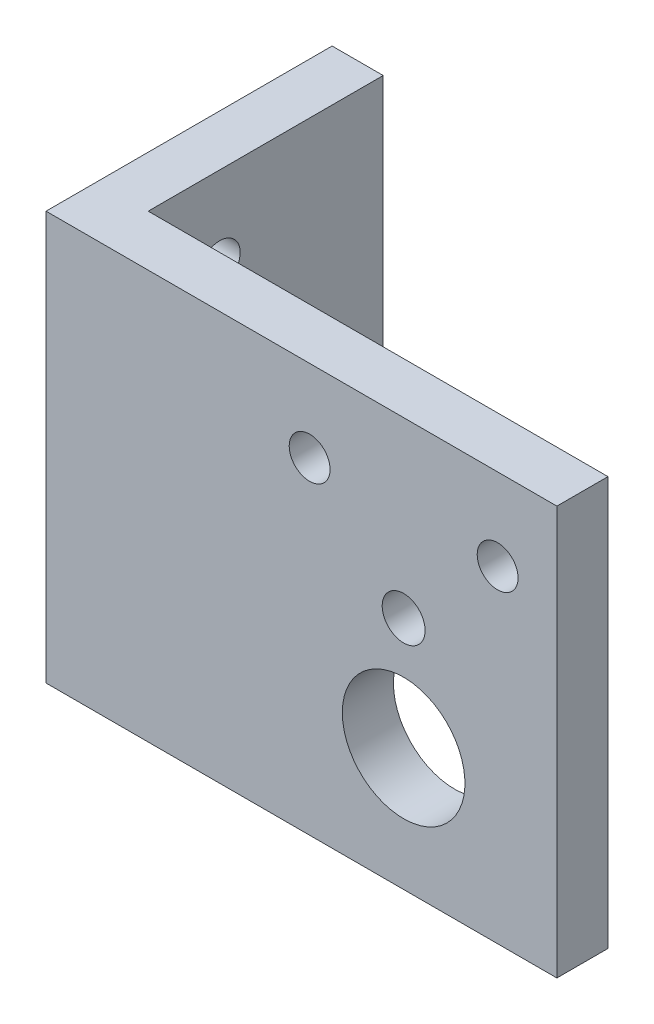
from build123d import *

# Parameters (mm, degrees)
BOSS_EXTRUDE2_DEPTH = 40
SKETCH3_R           = 6
SKETCH3_R_2         = 2.1
SKETCH3_R_3         = 2
CUT_EXTRUDE1_DEPTH  = 71.710678119
SKETCH4_R           = 2
CUT_EXTRUDE3_DEPTH  = 10
RIB3_REACH          = 66.226
SKETCH7_WALL_W      = 151.665529222
SKETCH7_WALL_H      = 10
SKETCH8_W           = 7
SKETCH8_H           = 40
CUT_EXTRUDE4_DEPTH  = 70.641941386
SKETCH9_R           = 3.25
CUT_EXTRUDE5_DEPTH  = 67.400301204
SKETCH10_R          = 2
CUT_EXTRUDE6_DEPTH  = 67.400301204


with BuildPart() as part:
    # Sketch1 → Boss-Extrude2 (new body)
    with BuildSketch(Plane(origin=(0, 0, 0), x_dir=(1, 0, 0), z_dir=(0, 1, 0))):
        Polygon((0, 0), (50, 0), (50, 5), (5, 5), (5, 35), (0, 35), align=None)
    extrude(amount=BOSS_EXTRUDE2_DEPTH)

    # Sketch3 → Cut-Extrude1 (cut, through all)
    with BuildSketch(Plane(origin=(0, 0, -5), x_dir=(-1, 0, 0), z_dir=(0, 0, -1))):
        with Locations((-35, 12)):
            Circle(SKETCH3_R)
        with Locations((-35, 23)):
            Circle(SKETCH3_R_2)
        with Locations((-44.2, 32)):
            Circle(SKETCH3_R_3)
        with Locations((-25.8, 32)):
            Circle(SKETCH3_R_3)
    extrude(amount=-CUT_EXTRUDE1_DEPTH, mode=Mode.SUBTRACT)

    # Sketch4 → Cut-Extrude3 (cut)
    with BuildSketch(Plane(origin=(5, 0, 0), x_dir=(0, 0, -1), z_dir=(1, 0, 0))):
        with Locations((12, 32)):
            Circle(SKETCH4_R)
        with Locations((12, 8)):
            Circle(SKETCH4_R)
    extrude(amount=-CUT_EXTRUDE3_DEPTH, mode=Mode.SUBTRACT)

    # Sketch7 wall → Rib3 (add, up to next)
    with BuildSketch(Plane(origin=(12.5, 20, -12.5), x_dir=(0.707106781187, 0, 0.707106781187), z_dir=(0.707106781187, 0, -0.707106781187)), mode=Mode.PRIVATE) as rib3_sk1:
        Rectangle(SKETCH7_WALL_W, SKETCH7_WALL_H)
    rib3_tool1 = extrude(rib3_sk1.sketch, amount=-RIB3_REACH, mode=Mode.PRIVATE) - part.part
    add(rib3_tool1.solids().sort_by_distance((12.5, 20, -12.5))[0])

    # Sketch8 → Cut-Extrude4 (cut, through all)
    with BuildSketch(Plane(origin=(5, 0, 0), x_dir=(0, 0, -1), z_dir=(1, 0, 0))):
        with Locations((31.5, 20)):
            Rectangle(SKETCH8_W, SKETCH8_H)
    extrude(amount=-CUT_EXTRUDE4_DEPTH, mode=Mode.SUBTRACT)

    # Sketch9 → Cut-Extrude5 (cut, through all)
    with BuildSketch(Plane(origin=(5, 0, 0), x_dir=(0, 0, -1), z_dir=(1, 0, 0))):
        with Locations((20, 20)):
            Circle(SKETCH9_R)
    extrude(amount=CUT_EXTRUDE5_DEPTH, mode=Mode.SUBTRACT)

    # Sketch10 → Cut-Extrude6 (cut, through all)
    with BuildSketch(Plane(origin=(5, 0, 0), x_dir=(0, 0, -1), z_dir=(1, 0, 0))):
        with Locations((20, 20)):
            Circle(SKETCH10_R)
    extrude(amount=-CUT_EXTRUDE6_DEPTH, mode=Mode.SUBTRACT)


solid = part.part
